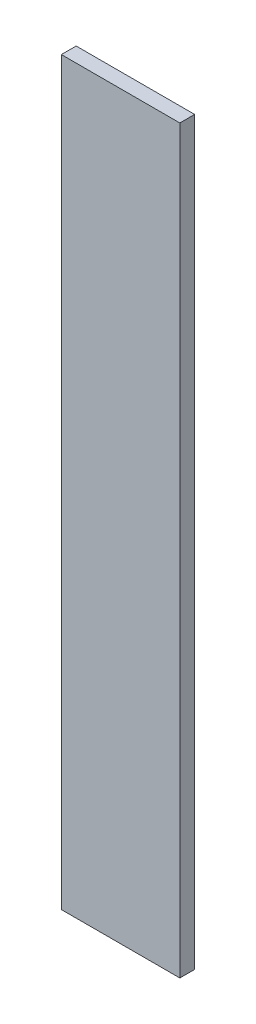
from build123d import *

# Parameters (mm, degrees)
SKETCH1_W           = 240
SKETCH1_H           = 1500
BOSS_EXTRUDE1_DEPTH = 30


with BuildPart() as part:
    # Sketch1 → Boss-Extrude1 (new body)
    with BuildSketch(Plane.XY):
        with Locations((-150, -107.462689126)):
            Rectangle(SKETCH1_W, SKETCH1_H)
    extrude(amount=-BOSS_EXTRUDE1_DEPTH)


solid = part.part
